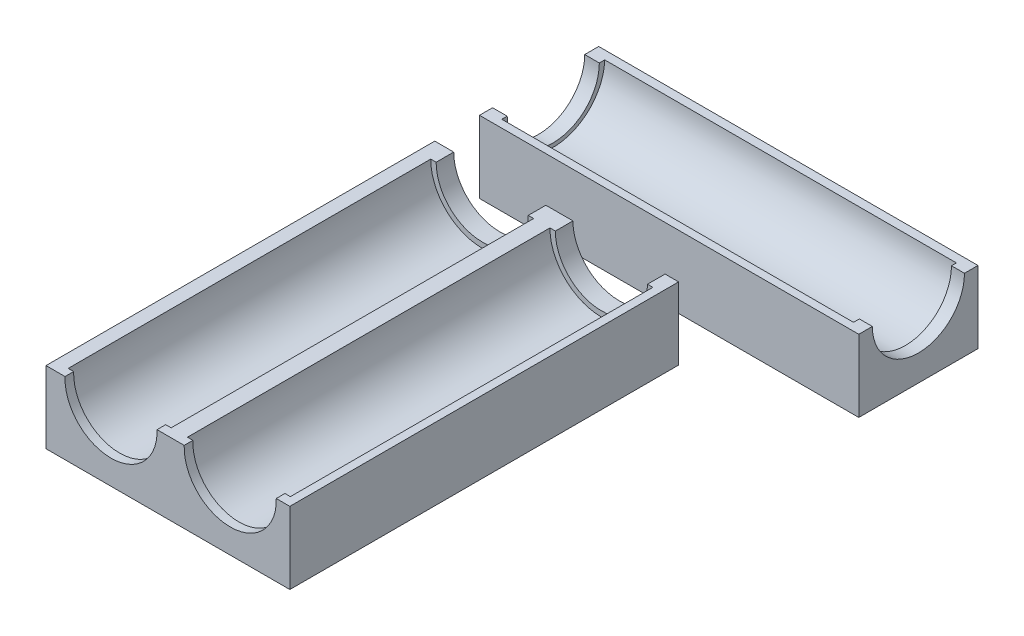
from build123d import *

# Parameters (mm, degrees)
BOSS_EXTRU_1_DEPTH           = 13.3
ESQUISSE2_R                  = 8.5
ENL_V_MAT_EXTRU_1_DEPTH      = 68
ENL_V_MAT_EXTRU_2_DEPTH      = 66.4
ENL_V_MAT_EXTRU_2_DEPTH_BACK = 0.5
ESQUISSE3_R                  = 9.5
ESQUISSE5_W                  = 8.253832041
ESQUISSE5_H                  = 13.3
ENL_V_MAT_EXTRU_3_DEPTH      = 113.275954683
ESQUISSE7_R                  = 8.5
ENL_V_MAT_EXTRU_5_DEPTH      = 4
ESQUISSE6_R                  = 8.5
ENL_V_MAT_EXTRU_4_DEPTH      = 67.3
ESQUISSE8_R                  = 9.5
ENL_V_MAT_EXTRU_6_DEPTH      = 64.9
ESQUISSE9_R                  = 8.5
ENL_V_MAT_EXTRU_7_DEPTH      = 64.2


with BuildPart() as part:
    # Esquisse1 → Boss.-Extru.1 (new body)
    with BuildSketch(Plane(origin=(0, 0, 0), x_dir=(1, 0, 0), z_dir=(0, 1, 0))):
        Polygon((0, 0), (0, 102), (70, 102), (70, 80), (45, 80), (45, 0), align=None)
    extrude(amount=BOSS_EXTRU_1_DEPTH)

    # Esquisse2 → Enlèv. mat.-Extru.1 (cut)
    with BuildSketch(Plane.XY):
        with Locations((12, 13)):
            Circle(ESQUISSE2_R)
        with Locations((34, 13)):
            Circle(ESQUISSE2_R)
    extrude(amount=-ENL_V_MAT_EXTRU_1_DEPTH, mode=Mode.SUBTRACT)

    # Esquisse3 → Enlèv. mat.-Extru.2 (cut, two sides: drawn at the far end of the back side and taken through both)
    with BuildSketch(Plane.XY.offset(-68).offset(-ENL_V_MAT_EXTRU_2_DEPTH_BACK)):
        with Locations((12, 13.3)):
            Circle(ESQUISSE3_R)
        with Locations((34, 13.3)):
            Circle(ESQUISSE3_R)
    extrude(amount=ENL_V_MAT_EXTRU_2_DEPTH + ENL_V_MAT_EXTRU_2_DEPTH_BACK, mode=Mode.SUBTRACT)

    # Esquisse5 → Enlèv. mat.-Extru.3 (cut, through all)
    with BuildSketch(Plane(origin=(45, 0, 0), x_dir=(0, 0, -1), z_dir=(1, 0, 0))):
        with Locations((75.873083979, 6.65)):
            Rectangle(ESQUISSE5_W, ESQUISSE5_H)
    extrude(amount=-ENL_V_MAT_EXTRU_3_DEPTH, mode=Mode.SUBTRACT)


with BuildPart() as enl_v_mat_extru_3_piece_1:
    # of the separate pieces the step leaves, piece 1, a body of its own (enl_v_mat_extru_3_pieces)
    add(part.part.solids().sort_by_distance((0, 0, 0))[0])

    # Esquisse7 → Enlèv. mat.-Extru.5 (cut)
    with BuildSketch(Plane.XY.offset(-68.5)):
        with Locations((34, 13.3)):
            Circle(ESQUISSE7_R)
        with Locations((12, 13.3)):
            Circle(ESQUISSE7_R)
    extrude(amount=-ENL_V_MAT_EXTRU_5_DEPTH, mode=Mode.SUBTRACT)


with BuildPart() as enl_v_mat_extru_3_piece_2:
    # of the separate pieces the step leaves, piece 2, a body of its own (enl_v_mat_extru_3_pieces)
    add(part.part.solids().sort_by_distance((0, 0, -80))[0])

    # Esquisse6 → Enlèv. mat.-Extru.4 (cut)
    with BuildSketch(Plane(origin=(70, 0, 0), x_dir=(0, 0, -1), z_dir=(1, 0, 0))):
        with Locations((91.003264198, 13.3)):
            Circle(ESQUISSE6_R)
    extrude(amount=-ENL_V_MAT_EXTRU_4_DEPTH, mode=Mode.SUBTRACT)

    # Esquisse8 → Enlèv. mat.-Extru.6 (cut)
    with BuildSketch(Plane(origin=(2.7, 0, 0), x_dir=(0, 0, -1), z_dir=(1, 0, 0))):
        with Locations((90.915521259, 13.571033135)):
            Circle(ESQUISSE8_R)
    extrude(amount=ENL_V_MAT_EXTRU_6_DEPTH, mode=Mode.SUBTRACT)

    # Esquisse9 → Enlèv. mat.-Extru.7 (cut)
    with BuildSketch(Plane(origin=(2.7, 0, 0), x_dir=(0, 0, -1), z_dir=(1, 0, 0))):
        with Locations((90.915521259, 13.3)):
            Circle(ESQUISSE9_R)
    extrude(amount=-ENL_V_MAT_EXTRU_7_DEPTH, mode=Mode.SUBTRACT)


solid = Compound([enl_v_mat_extru_3_piece_1.part, enl_v_mat_extru_3_piece_2.part])
